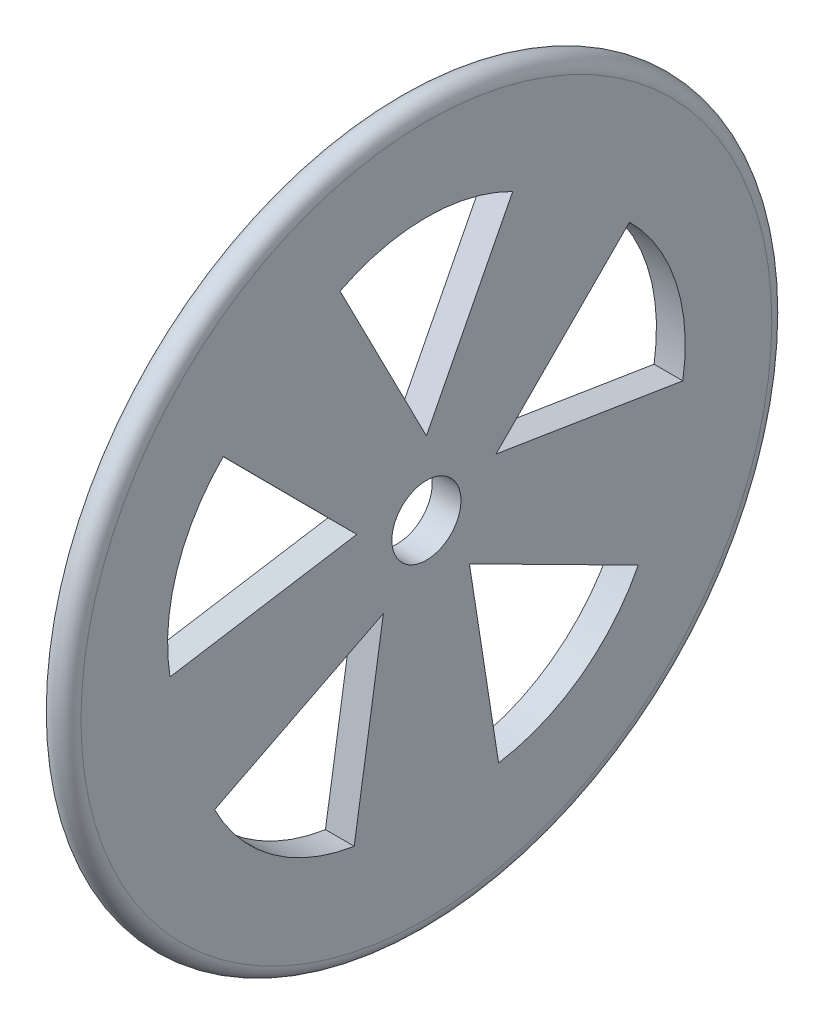
from build123d import *

# Parameters (mm, degrees)
SKETCH2_R          = 1.905
CUT_EXTRUDE1_DEPTH = 2.54


with BuildPart() as part:
    # Sketch1 → Revolve1 (revolve)
    with BuildSketch(Plane.XY, mode=Mode.PRIVATE) as revolve1_sk:
        with BuildLine():
            Line((0, 0), (0.79375, 0))
            Line((0.79375, 0), (0.79375, 19.05))
            ThreePointArc((0.79375, 19.05), (0, 19.84375), (-0.79375, 19.05))
            Line((-0.79375, 19.05), (-0.79375, 0))
            Line((-0.79375, 0), (0, 0))
        make_face()
    revolve(revolve1_sk.sketch.rotate(Axis((0, 0, 0), (-1, 0, 0)), 90), axis=Axis((0, 0, 0), (-1, 0, 0)))

    # Sketch2 → Cut-Extrude1 (cut)
    with BuildSketch(Plane(origin=(0.79375, 0, 0), x_dir=(0, 0, -1), z_dir=(1, 0, 0))):
        with BuildLine():
            Line((-4.760272123, 13.32409501), (0, 4.036897437))
            Line((0, 4.036897437), (0, 14.472999652))
            ThreePointArc((0, 14.472999652), (-2.448477719, 14.181708244), (-4.760272123, 13.32409501))
        make_face()
        with BuildLine():
            Line((0, 14.472999652), (0, 4.036897437))
            Line((0, 4.036897437), (4.760272123, 13.32409501))
            ThreePointArc((4.760272123, 13.32409501), (2.448477719, 14.181708244), (0, 14.472999652))
        make_face()
        with BuildLine():
            ThreePointArc((11.200962399, 8.644659614), (13.764640629, 4.472402852), (14.142972367, -0.409916029))
            Line((14.142972367, -0.409916029), (3.839317613, 1.247469913))
            Line((3.839317613, 1.247469913), (11.200962399, 8.644659614))
        make_face()
        with BuildLine():
            ThreePointArc((11.682847592, -7.981401547), (8.507015752, -11.708902678), (3.980565502, -13.577437048))
            Line((3.980565502, -13.577437048), (2.372828779, -3.265918631))
            Line((2.372828779, -3.265918631), (11.682847592, -7.981401547))
        make_face()
        with BuildLine():
            ThreePointArc((-3.980565502, -13.577437048), (-8.507015752, -11.708902678), (-11.682847592, -7.981401547))
            Line((-11.682847592, -7.981401547), (-2.372828779, -3.265918631))
            Line((-2.372828779, -3.265918631), (-3.980565502, -13.577437048))
        make_face()
        with BuildLine():
            Line((-3.839317613, 1.247469913), (-11.200962399, 8.644659614))
            ThreePointArc((-11.200962399, 8.644659614), (-13.764640629, 4.472402852), (-14.142972367, -0.409916029))
            Line((-14.142972367, -0.409916029), (-3.839317613, 1.247469913))
        make_face()
        Circle(SKETCH2_R)
    extrude(amount=-CUT_EXTRUDE1_DEPTH, mode=Mode.SUBTRACT)


solid = part.part
